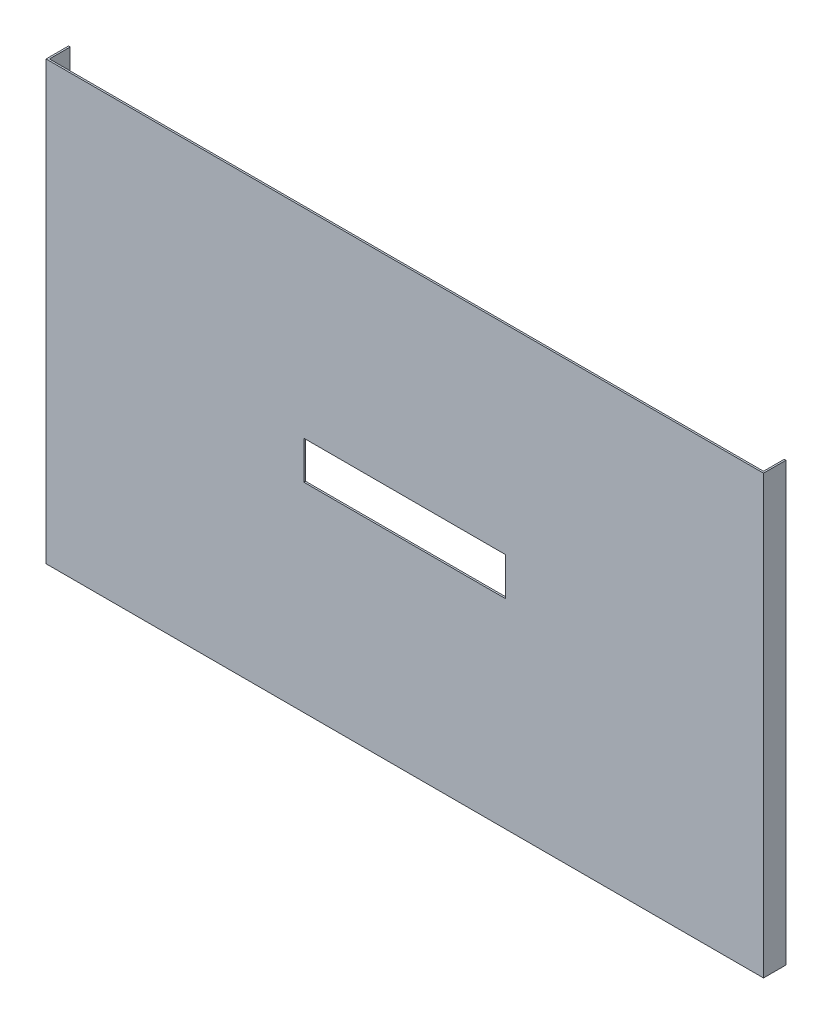
from build123d import *

# Parameters (mm, degrees)
TOPPING_KLAPE_KAT1_KAPAK_1_START = 1560
TOPPING_KLAPE_KAT1_KAPAK_1_DEPTH = 390
TOPPING_KLAPE_KAT1_KAPAK_2_START = 27
SKETCH2_W                        = 180
SKETCH2_H                        = 34
TOPPING_KLAPE_KAT1_KAPAK_2_DEPTH = 14


with BuildPart() as part:
    # Sketch1 → TOPPING_klape_kat1_kapak_1 (new body)
    with BuildSketch(Plane(origin=(0, 0, 0), x_dir=(1, 0, 0), z_dir=(0, 1, 0)).offset(TOPPING_KLAPE_KAT1_KAPAK_1_START)):
        Polygon((30, -40), (30, -20), (31.5, -20), (31.5, -38.5), (668.5, -38.5), (668.5, -20), (670, -20), (670, -40), align=None)
    extrude(amount=TOPPING_KLAPE_KAT1_KAPAK_1_DEPTH)

    # Sketch2 → TOPPING_klape_kat1_kapak_2 (cut)
    with BuildSketch(Plane.XY.offset(TOPPING_KLAPE_KAT1_KAPAK_2_START)):
        with Locations((350, 1755)):
            Rectangle(SKETCH2_W, SKETCH2_H)
    extrude(amount=TOPPING_KLAPE_KAT1_KAPAK_2_DEPTH, mode=Mode.SUBTRACT)


solid = part.part
